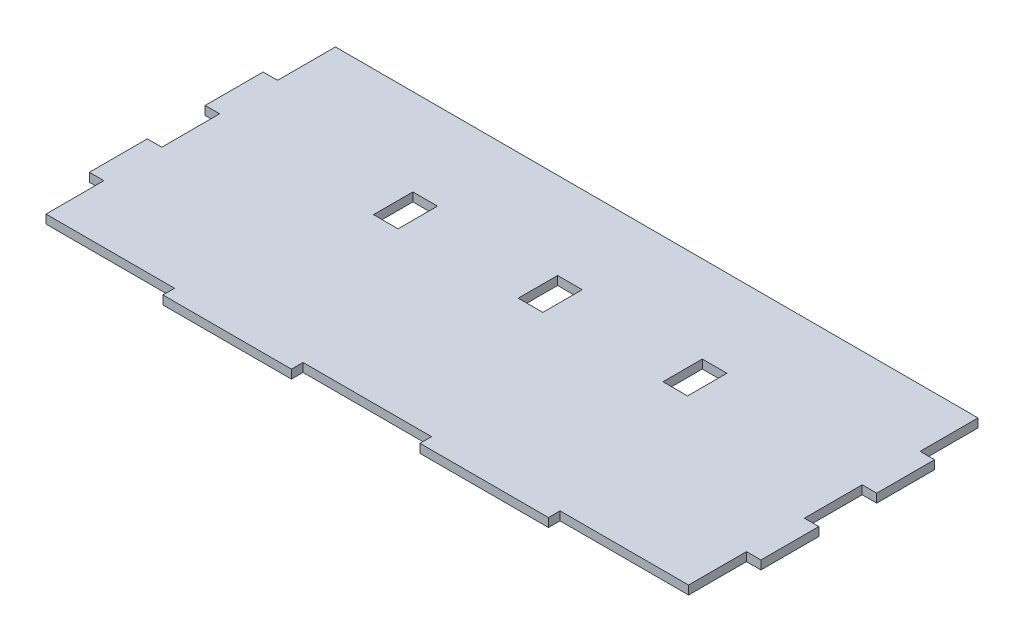
from build123d import *

# Parameters (mm, degrees)
SKETCH1_W           = 8.5
SKETCH1_H           = 13.6
BOSS_EXTRUDE1_DEPTH = 3


with BuildPart() as part:
    # Sketch1 → Boss-Extrude1 (new body)
    with BuildSketch(Plane(origin=(0, 0, 0), x_dir=(1, 0, 0), z_dir=(0, 1, 0))):
        Polygon((-111, 30), (-116, 30), (-116, 10), (-111, 10), (-111, -10), (-116, -10), (-116, -30), (-111, -30), (-111, -50), (-66.6, -50), (-66.6, -54), (-22.2, -54), (-22.2, -50), (22.2, -50), (22.2, -54), (66.6, -54), (66.6, -50), (111, -50), (111, -30), (116, -30), (116, -10), (111, -10), (111, 10), (116, 10), (116, 30), (111, 30), (111, 50), (-111, 50), align=None)
        with Locations((0, 13.2)):
            Rectangle(SKETCH1_W, SKETCH1_H, mode=Mode.SUBTRACT)
        with Locations((-50, 13.2)):
            Rectangle(SKETCH1_W, SKETCH1_H, mode=Mode.SUBTRACT)
        with Locations((50, 13.2)):
            Rectangle(SKETCH1_W, SKETCH1_H, mode=Mode.SUBTRACT)
    extrude(amount=BOSS_EXTRUDE1_DEPTH)


solid = part.part
